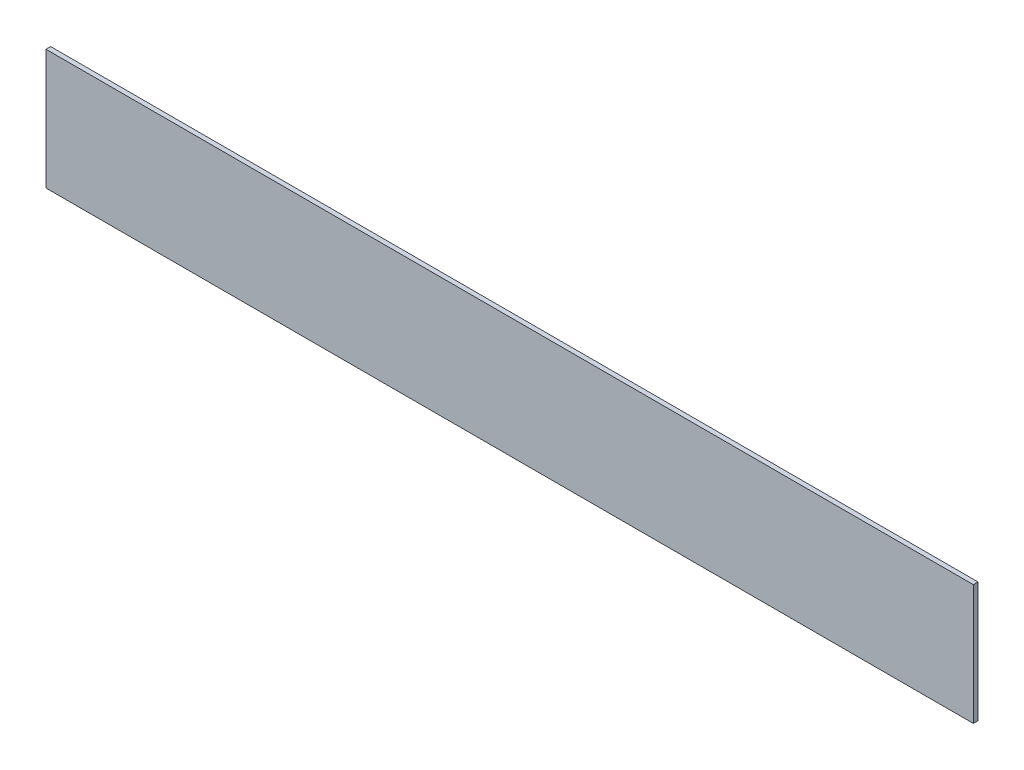
from build123d import *

# Parameters (mm, degrees)
SZKIC1_W                    = 594
SZKIC1_H                    = 77
DODANIE_WYCI_GNI_CIE1_DEPTH = 3


with BuildPart() as part:
    # Szkic1 → Dodanie-wyciągnięcie1 (new body)
    with BuildSketch(Plane.XY):
        with Locations((48.915484212, -242.574766355)):
            Rectangle(SZKIC1_W, SZKIC1_H)
    extrude(amount=DODANIE_WYCI_GNI_CIE1_DEPTH)


solid = part.part
